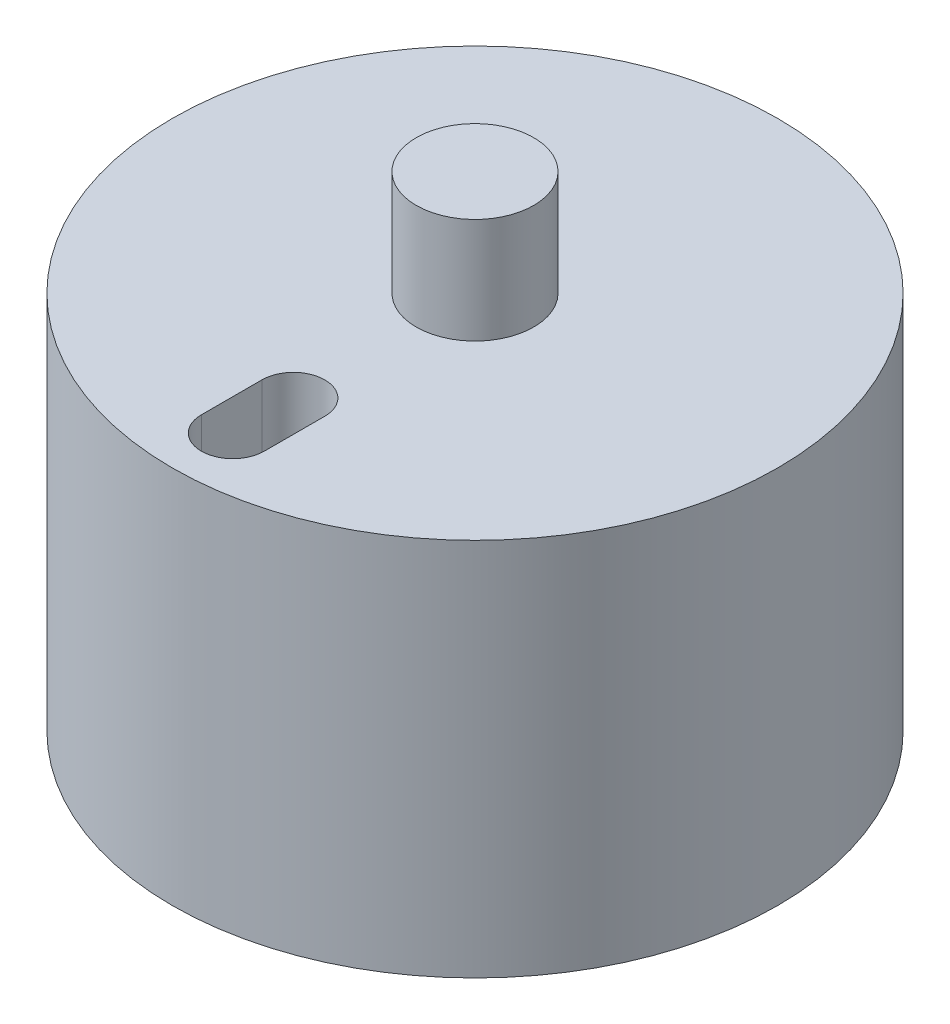
from build123d import *

# Parameters (mm, degrees)
SKETCH1_R           = 25
BOSS_EXTRUDE1_DEPTH = 40
CUT_EXTRUDE1_START  = -8.7
SKETCH2_R           = 25
SKETCH2_R_2         = 4.85
CUT_EXTRUDE1_DEPTH  = 8.7
CUT_EXTRUDE2_DEPTH  = 10
SKETCH5_R           = 1.5
CUT_EXTRUDE3_DEPTH  = 42.275779823


with BuildPart() as part:
    # Sketch1 → Boss-Extrude1 (new body)
    with BuildSketch(Plane(origin=(0, 0, 0), x_dir=(1, 0, 0), z_dir=(0, 1, 0))):
        with Locations(Location((0, 0, 0), (0, 0, 270))):
            Circle(SKETCH1_R)
    extrude(amount=BOSS_EXTRUDE1_DEPTH)

    # Sketch2 → Cut-Extrude1 (cut)
    with BuildSketch(Plane(origin=(0, 40, 0), x_dir=(1, 0, 0), z_dir=(0, 1, 0)).offset(CUT_EXTRUDE1_START)):
        with Locations(Location((0, 0, 0), (0, 0, 270))):
            Circle(SKETCH2_R)
        with Locations(Location((0, 0, 0), (0, 0, 270))):
            Circle(SKETCH2_R_2, mode=Mode.SUBTRACT)
    extrude(amount=CUT_EXTRUDE1_DEPTH, mode=Mode.SUBTRACT)

    # Sketch3 → Cut-Extrude2 (cut)
    with BuildSketch(Plane(origin=(0, 31.3, 0), x_dir=(1, 0, 0), z_dir=(0, 1, 0))):
        with BuildLine():
            Line((-2.6, -15), (-2.6, -20))
            ThreePointArc((-2.6, -20), (0, -22.6), (2.6, -20))
            Line((2.6, -20), (2.6, -15))
            ThreePointArc((2.6, -15), (0, -12.4), (-2.6, -15))
        make_face()
    extrude(amount=-CUT_EXTRUDE2_DEPTH, mode=Mode.SUBTRACT)

    # Sketch5 → Cut-Extrude3 (cut, through all)
    with BuildSketch(Plane(origin=(0, 21.3, 0), x_dir=(1, 0, 0), z_dir=(0, 1, 0))):
        with Locations(Location((0, -17.5, 0), (0, 0, 270))):
            Circle(SKETCH5_R)
    extrude(amount=-CUT_EXTRUDE3_DEPTH, mode=Mode.SUBTRACT)


solid = part.part
